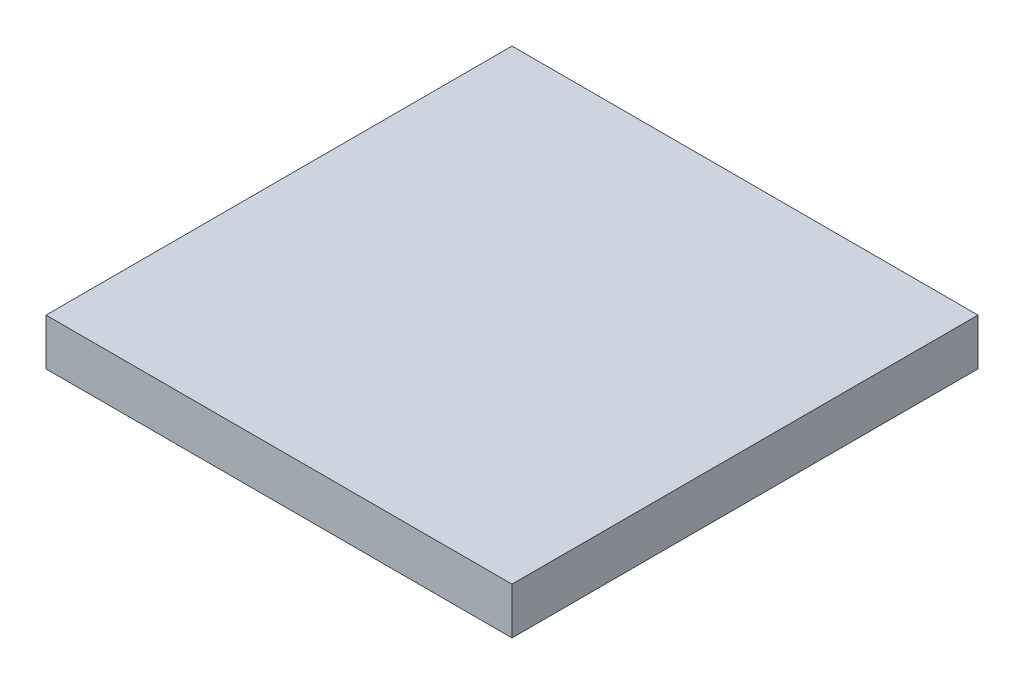
from build123d import *

# Parameters (mm, degrees)
SKETCH_1_W      = 25
SKETCH_1_H      = 25
EXTRUDE_1_DEPTH = 2.5


with BuildPart() as part:
    # 草图1 → 凸台-拉伸1 (new body)
    with BuildSketch(Plane(origin=(0, 0, 0), x_dir=(1, 0, 0), z_dir=(0, 1, 0))):
        Rectangle(SKETCH_1_W, SKETCH_1_H)
    extrude(amount=-EXTRUDE_1_DEPTH)


solid = part.part
